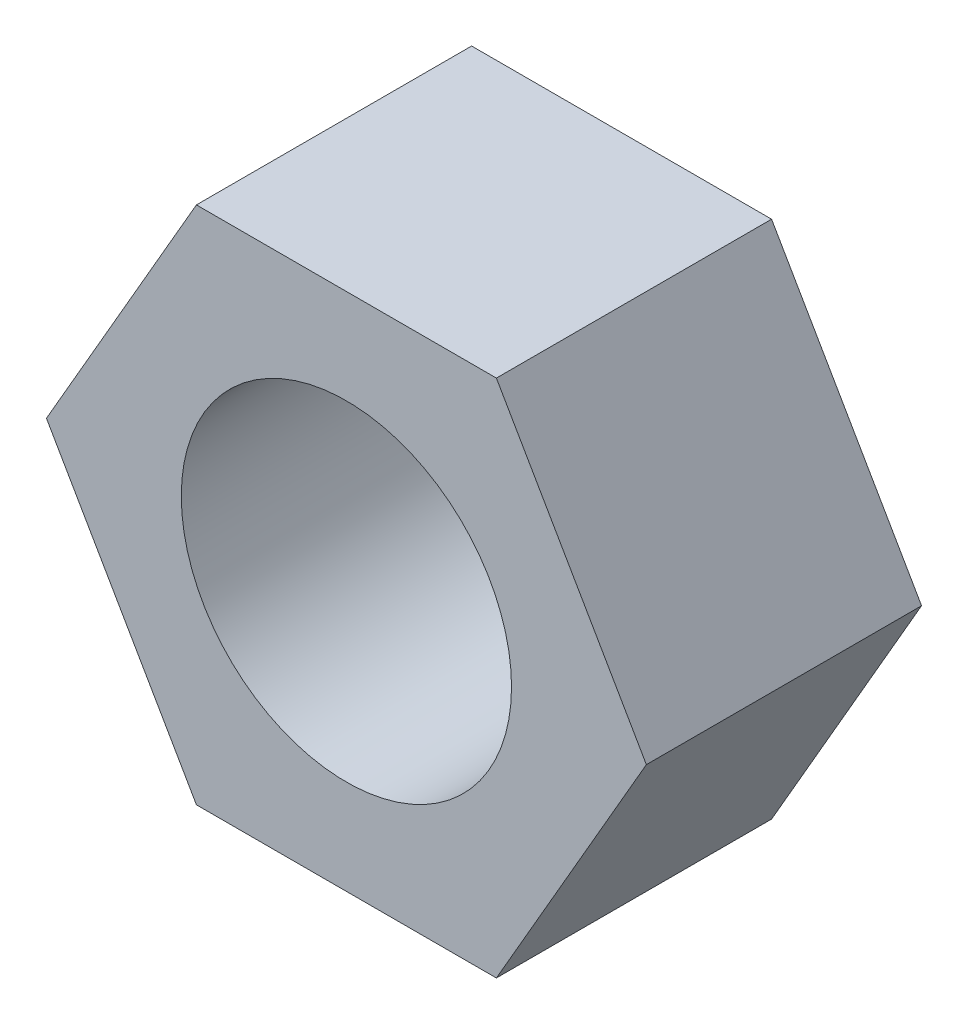
from build123d import *

# Parameters (mm, degrees)
SKETCH1_R           = 3
BOSS_EXTRUDE1_DEPTH = 5


with BuildPart() as part:
    # Sketch1 → Boss-Extrude1 (new body)
    with BuildSketch(Plane.XY):
        Polygon((5.45, 0), (2.725, 4.719838451), (-2.725, 4.719838451), (-5.45, 0), (-2.725, -4.719838451), (2.725, -4.719838451), align=None)
        Circle(SKETCH1_R, mode=Mode.SUBTRACT)
    extrude(amount=BOSS_EXTRUDE1_DEPTH)


solid = part.part
